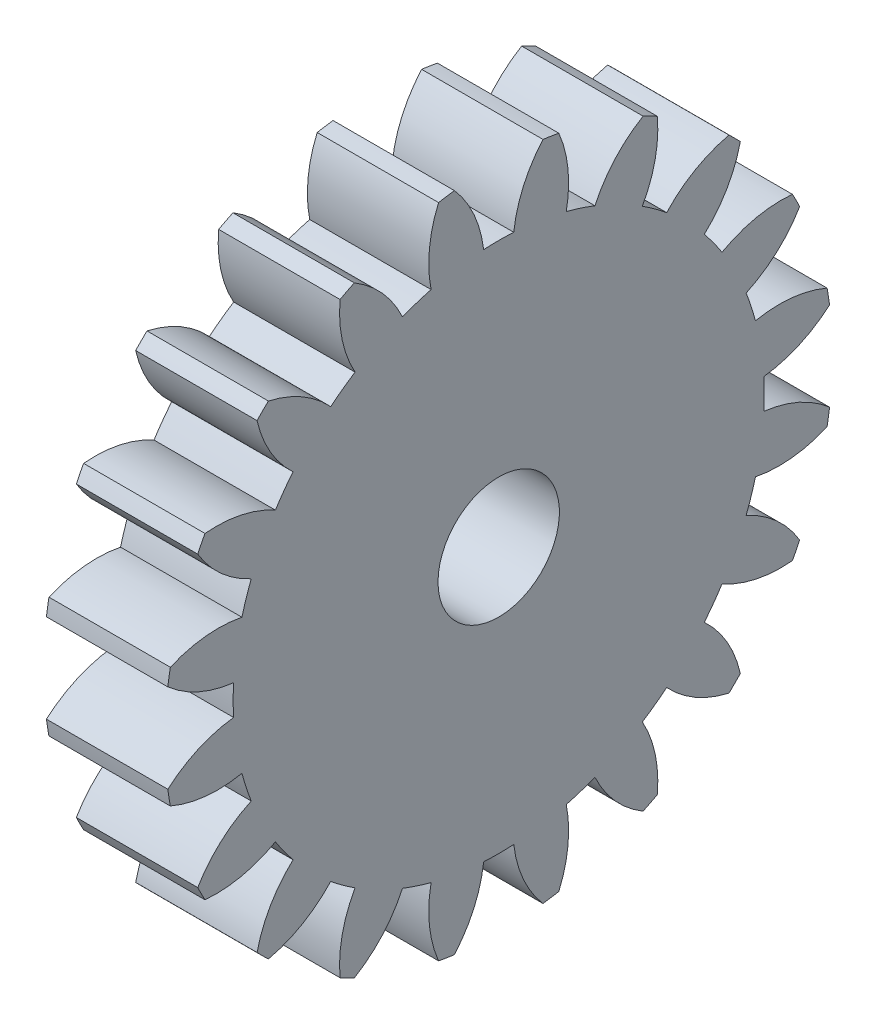
from build123d import *

# Parameters (mm, degrees)
BASPROSKE_W     = 6
BASPROSKE_H     = 16.5
TOOTHCUT_DEPTH  = 25.093567606
TEETHCUTS_COUNT = 20
TEETHCUTS_ANGLE = 342
BORSKE_R        = 3
BORE_DEPTH      = 50.0000508


with BuildPart() as part:
    # BasProSke → Base-Revolve (revolve)
    with BuildSketch(Plane(origin=(0, 0, 0), x_dir=(1, 0, 0), z_dir=(0, 1, 0)), mode=Mode.PRIVATE) as base_revolve_sk:
        with Locations((3, 8.25)):
            Rectangle(BASPROSKE_W, BASPROSKE_H)
    revolve(base_revolve_sk.sketch.rotate(Axis((-10, 0, 0), (1, 0, 0)), 180), axis=Axis((-10, 0, 0), (1, 0, 0)))

    # TooCutSke → ToothCut (cut, through all)
    with BuildSketch(Plane(origin=(0, 0, 0), x_dir=(0, 0, -1), z_dir=(1, 0, 0))):
        with BuildLine():
            ThreePointArc((0.74381438, 13.102904875), (0, 13.124), (-0.74381438, 13.102904875))
            ThreePointArc((-0.74381438, 13.102904875), (-1.226473103, 14.852072512), (-2.209965745, 16.376962373))
            ThreePointArc((-2.209965745, 16.376962373), (0, 16.5254), (2.209965745, 16.376962373))
            ThreePointArc((2.209965745, 16.376962373), (1.226473103, 14.852072512), (0.74381438, 13.102904875))
        make_face()
    toothcut = extrude(amount=TOOTHCUT_DEPTH, mode=Mode.SUBTRACT)

    # TeethCuts: ToothCut ×20 about axis
    teethcuts_axis = Axis((-10, 0, 0), (1, 0, 0))
    for i in range(1, TEETHCUTS_COUNT):
        add(toothcut.rotate(teethcuts_axis, i * TEETHCUTS_ANGLE / (TEETHCUTS_COUNT - 1)), mode=Mode.SUBTRACT)

    # BorSke → Bore (cut, symmetric)
    with BuildSketch(Plane(origin=(0, 0, 0), x_dir=(0, 0, -1), z_dir=(1, 0, 0))):
        with Locations(Location((0, 0, 0), (0, 0, 180))):
            Circle(BORSKE_R)
    extrude(amount=BORE_DEPTH, both=True, mode=Mode.SUBTRACT)


solid = part.part
